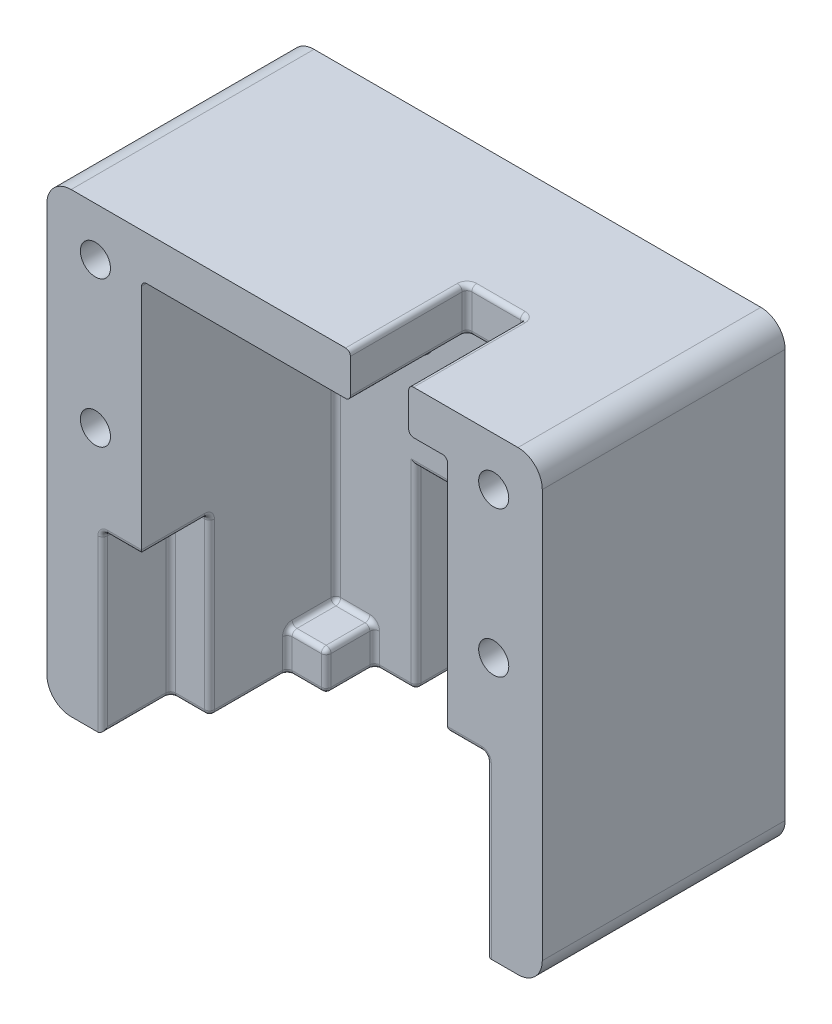
from build123d import *

# Parameters (mm, degrees)
SKETCH1_W           = 51
SKETCH1_H           = 47
BOSS_EXTRUDE1_DEPTH = 5
BOSS_EXTRUDE2_DEPTH = 20
SKETCH4_W           = 4
SKETCH4_H           = 4
BOSS_EXTRUDE3_DEPTH = 5
SKETCH5_W           = 4
SKETCH5_H           = 18
CUT_EXTRUDE1_DEPTH  = 7
SKETCH7_W           = 6
SKETCH7_H           = 4.5
CUT_EXTRUDE2_DEPTH  = 12
CUT_EXTRUDE3_DEPTH  = 4
SKETCH9_R           = 1.55
CUT_EXTRUDE4_DEPTH  = 10
SKETCH10_R          = 1.75
CUT_EXTRUDE5_DEPTH  = 73.18032973
SKETCH11_R          = 2.5
CUT_EXTRUDE6_DEPTH  = 2
FILLET1_R           = 0.5
FILLET2_R           = 2.5


with BuildPart() as part:
    # Sketch1 → Boss-Extrude1 (new body)
    with BuildSketch(Plane.XY):
        with Locations((25.5, 23.5)):
            Rectangle(SKETCH1_W, SKETCH1_H)
    extrude(amount=BOSS_EXTRUDE1_DEPTH)

    # Sketch2 → Boss-Extrude2 (add)
    with BuildSketch(Plane.XY.offset(5)):
        Polygon((0, 0), (0, 47), (51, 47), (51, 0), (41.25, 0), (41.25, 42.5), (9.75, 42.5), (9.75, 0), align=None)
    extrude(amount=BOSS_EXTRUDE2_DEPTH)

    # Sketch4 → Boss-Extrude3 (add)
    with BuildSketch(Plane.XY.offset(5)):
        with Locations((39.25, 2)):
            Rectangle(SKETCH4_W, SKETCH4_H)
        with Locations((11.75, 2)):
            Rectangle(SKETCH4_W, SKETCH4_H)
    extrude(amount=BOSS_EXTRUDE3_DEPTH)

    # Sketch5 → Cut-Extrude1 (cut)
    with BuildSketch(Plane.XY.offset(25)):
        with Locations((43.25, 9)):
            Rectangle(SKETCH5_W, SKETCH5_H)
        with Locations((7.75, 9)):
            Rectangle(SKETCH5_W, SKETCH5_H)
    extrude(amount=-CUT_EXTRUDE1_DEPTH, mode=Mode.SUBTRACT)

    # Sketch7 → Cut-Extrude2 (cut)
    with BuildSketch(Plane.XY.offset(25)):
        with Locations((34.25, 44.75)):
            Rectangle(SKETCH7_W, SKETCH7_H)
    extrude(amount=-CUT_EXTRUDE2_DEPTH, mode=Mode.SUBTRACT)

    # Sketch8 → Cut-Extrude3 (cut)
    with BuildSketch(Plane.XY.offset(5)):
        Polygon((25.5, 0), (33, 0), (33, 20), (18, 20), (18, 0), align=None)
    extrude(amount=-CUT_EXTRUDE3_DEPTH, mode=Mode.SUBTRACT)

    # Sketch9 → Cut-Extrude4 (cut)
    with BuildSketch(Plane.XY.offset(25)):
        with Locations((5, 27)):
            Circle(SKETCH9_R)
        with Locations((5, 42)):
            Circle(SKETCH9_R)
        with Locations((46, 42)):
            Circle(SKETCH9_R)
        with Locations((46, 27)):
            Circle(SKETCH9_R)
    extrude(amount=-CUT_EXTRUDE4_DEPTH, mode=Mode.SUBTRACT)

    # Sketch10 → Cut-Extrude5 (cut, through all)
    with BuildSketch(Plane.XY.offset(5)):
        with Locations((17.5, 32.5)):
            Circle(SKETCH10_R)
        with Locations((33.5, 32.5)):
            Circle(SKETCH10_R)
    extrude(amount=-CUT_EXTRUDE5_DEPTH, mode=Mode.SUBTRACT)

    # Sketch11 → Cut-Extrude6 (cut)
    with BuildSketch(Plane.XY.offset(5)):
        with Locations((17.5, 32.5)):
            Circle(SKETCH11_R)
        with Locations((33.5, 32.5)):
            Circle(SKETCH11_R)
    extrude(amount=-CUT_EXTRUDE6_DEPTH, mode=Mode.SUBTRACT)

    # Fillet1
    fillet1_edges = [part.edges().sort_by_distance(p)[0] for p in [
        (35.125, 0, 5),
        (18, 10, 1),
        (18, 0, 3),
        (25.5, 20, 1),
        (33, 10, 1),
        (25.5, 0, 1),
        (33, 0, 3),
        (18, 10, 5),
        (33, 10, 5),
        (25.5, 20, 5),
        (25.5, 42.5, 5),
        (9.75, 42.5, 15),
        (41.25, 23.25, 5),
        (41.25, 42.5, 15),
        (39.25, 4, 5),
        (41.25, 4, 7.5),
        (37.25, 2, 5),
        (37.25, 4, 7.5),
        (37.25, 0, 7.5),
        (41.25, 2, 10),
        (39.25, 4, 10),
        (37.25, 2, 10),
        (39.25, 0, 10),
        (9.75, 23.25, 5),
        (15.875, 0, 5),
        (9.75, 4, 7.5),
        (13.75, 2, 5),
        (13.75, 0, 7.5),
        (11.75, 4, 5),
        (13.75, 4, 7.5),
        (9.75, 2, 10),
        (11.75, 0, 10),
        (13.75, 2, 10),
        (11.75, 4, 10),
        (9.75, 0, 14),
        (41.25, 0, 14),
        (43.25, 0, 18),
        (45.25, 0, 21.5),
        (41.25, 9, 18),
        (43.25, 18, 18),
        (41.25, 18, 21.5),
        (45.25, 9, 18),
        (45.25, 18, 21.5),
        (45.25, 9, 25),
        (43.25, 18, 25),
        (7.75, 0, 18),
        (5.75, 9, 18),
        (5.75, 0, 21.5),
        (7.75, 18, 18),
        (5.75, 18, 21.5),
        (9.75, 9, 18),
        (9.75, 18, 21.5),
        (7.75, 18, 25),
        (5.75, 9, 25),
        (34.25, 47, 13),
        (31.25, 47, 19),
        (37.25, 44.75, 13),
        (37.25, 47, 19),
        (34.25, 42.5, 13),
        (37.25, 42.5, 19),
        (31.25, 44.75, 13),
        (31.25, 42.5, 19),
    ]]
    fillet(fillet1_edges, radius=FILLET1_R)

    # Fillet2
    fillet2_edges = [part.edges().sort_by_distance(p)[0] for p in [
        (0, 47, 12.5),
        (51, 47, 12.5),
        (51, 0, 12.5),
        (0, 0, 12.5),
    ]]
    fillet(fillet2_edges, radius=FILLET2_R)


solid = part.part
